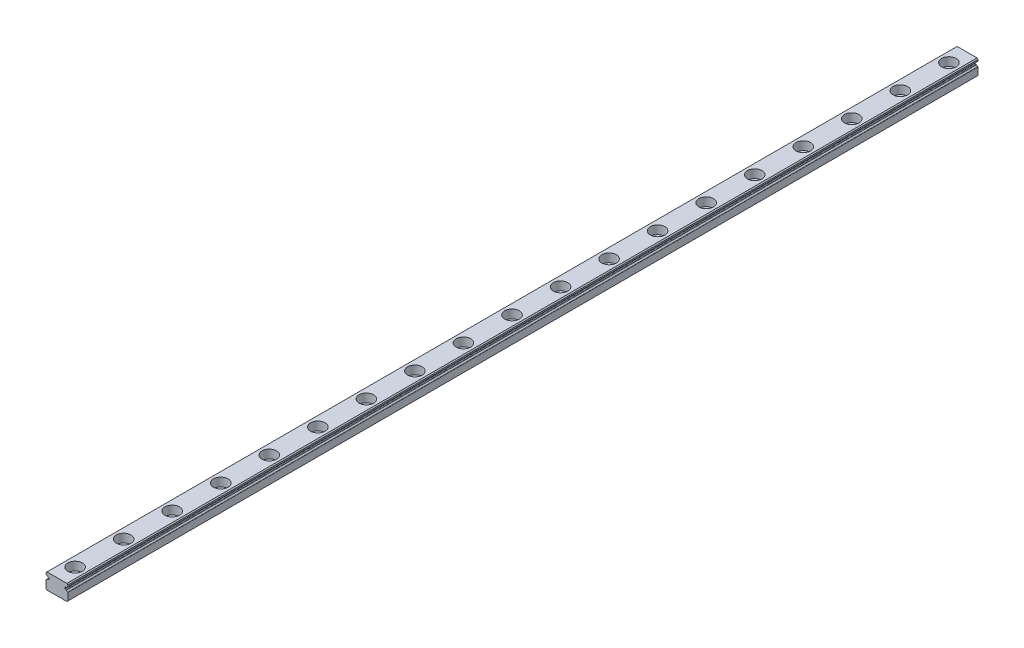
from build123d import *

# Parameters (mm, degrees)
BOSS_EXTRUDE1_START = 187.5
BOSS_EXTRUDE1_DEPTH = 375
LPATTERN1_COUNT     = 19
LPATTERN1_PITCH     = 20


with BuildPart() as part:
    # Sketch3 → Boss-Extrude1 (new body)
    with BuildSketch(Plane.XY.offset(BOSS_EXTRUDE1_START)):
        with BuildLine():
            Line((-4.5, 0.191696476), (-4.5, -2.85))
            Line((-4.5, -2.85), (-4.1, -3.25))
            Line((-4.1, -3.25), (1.4, -3.25))
            ThreePointArc((1.4, -3.25), (1.8, -3.05), (2.2, -3.25))
            Line((2.2, -3.25), (4.1, -3.25))
            Line((4.1, -3.25), (4.5, -2.85))
            Line((4.5, -2.85), (4.5, 0.191696476))
            ThreePointArc((4.5, 0.191696476), (4.475108648, 0.274448068), (4.408695652, 0.329735674))
            ThreePointArc((4.408695652, 0.329735674), (4.141262777, 0.497623907), (3.939510483, 0.740528855))
            ThreePointArc((3.939510483, 0.740528855), (3.890337026, 0.791057421), (3.823510417, 0.813537838))
            Line((3.823510417, 0.813537838), (3.482568852, 0.84336636))
            ThreePointArc((3.482568852, 0.84336636), (3.352544533, 0.907487258), (3.3, 1.042605299))
            Line((3.3, 1.042605299), (3.3, 1.457394701))
            ThreePointArc((3.3, 1.457394701), (3.352544533, 1.592512742), (3.482568852, 1.65663364))
            Line((3.482568852, 1.65663364), (3.823514163, 1.68646249))
            ThreePointArc((3.823514163, 1.68646249), (3.890340367, 1.708942652), (3.939513741, 1.759470648))
            ThreePointArc((3.939513741, 1.759470648), (4.141265182, 2.002372199), (4.408695652, 2.170258326))
            ThreePointArc((4.408695652, 2.170258326), (4.475108648, 2.225545932), (4.5, 2.308297524))
            Line((4.5, 2.308297524), (4.5, 2.85))
            Line((4.5, 2.85), (4.1, 3.25))
            Line((4.1, 3.25), (-4.1, 3.25))
            Line((-4.1, 3.25), (-4.5, 2.85))
            Line((-4.5, 2.85), (-4.5, 2.308297524))
            ThreePointArc((-4.5, 2.308297524), (-4.475108648, 2.225545932), (-4.408695652, 2.170258326))
            ThreePointArc((-4.408695652, 2.170258326), (-4.141265182, 2.002372199), (-3.939513741, 1.759470648))
            ThreePointArc((-3.939513741, 1.759470648), (-3.890340367, 1.708942652), (-3.823514163, 1.68646249))
            Line((-3.823514163, 1.68646249), (-3.482568852, 1.65663364))
            ThreePointArc((-3.482568852, 1.65663364), (-3.352544533, 1.592512742), (-3.3, 1.457394701))
            Line((-3.3, 1.457394701), (-3.3, 1.042605299))
            ThreePointArc((-3.3, 1.042605299), (-3.352544533, 0.907487258), (-3.482568852, 0.84336636))
            Line((-3.482568852, 0.84336636), (-3.823510417, 0.813537838))
            ThreePointArc((-3.823510417, 0.813537838), (-3.890337026, 0.791057421), (-3.939510483, 0.740528855))
            ThreePointArc((-3.939510483, 0.740528855), (-4.141262777, 0.497623907), (-4.408695652, 0.329735674))
            ThreePointArc((-4.408695652, 0.329735674), (-4.475108648, 0.274448068), (-4.5, 0.191696476))
        make_face()
    extrude(amount=-BOSS_EXTRUDE1_DEPTH)

    # Sketch4 → Cut-Revolve1 (revolve, cut)
    with BuildSketch(Plane.XY.offset(180)):
        Polygon((0, 3.25), (0, -3.25), (-1.75, -3.25), (-1.75, -0.25), (-3, -0.25), (-3, 3.25), align=None)
    cut_revolve1 = revolve(axis=Axis((0, 3.25, 180), (0, -1, 0)), mode=Mode.SUBTRACT)

    # LPattern1: Cut-Revolve1 ×19
    with Locations(*[(0, 0, -i * LPATTERN1_PITCH) for i in range(1, LPATTERN1_COUNT)]):
        add(cut_revolve1, mode=Mode.SUBTRACT)


solid = part.part
